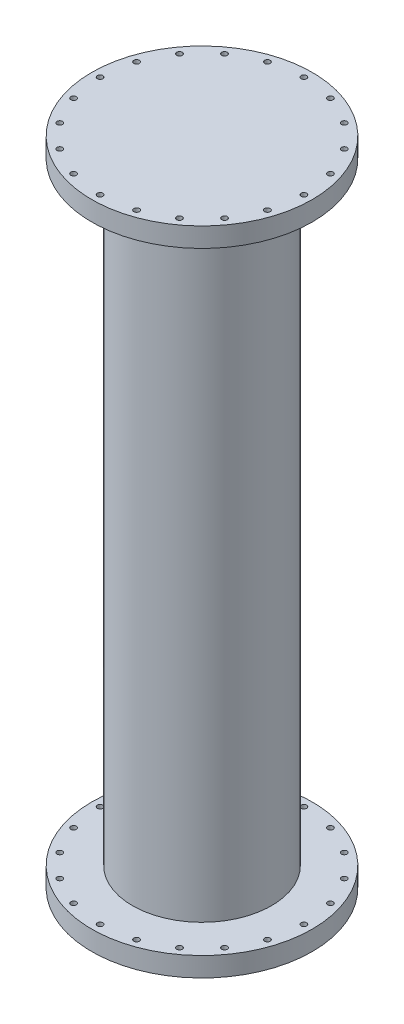
from build123d import *

# Parameters (mm, degrees)
ESQUISSE2_R                  = 10
ENL_V_MAT_EXTRU_1_DEPTH      = 2407.082292857
R_P_TITION_CIRCULAIRE1_COUNT = 20


with BuildPart() as part:
    # Esquisse1 → Révolution1 (revolve)
    with BuildSketch(Plane.XY, mode=Mode.PRIVATE) as r_volution1_sk:
        Polygon((0, 0), (396, 0), (396, -70), (250, -70), (250, -2270), (396, -2270), (396, -2340), (0, -2340), (0, -2270), (200, -2270), (200, -70), (0, -70), align=None)
    revolve(r_volution1_sk.sketch.rotate(Axis((0, 0, 0), (0, -1, 0)), 180), axis=Axis((0, 0, 0), (0, -1, 0)))

    # Esquisse2 → Enlèv. mat.-Extru.1 (cut, through all)
    with BuildSketch(Plane(origin=(0, 0, 0), x_dir=(1, 0, 0), z_dir=(0, 1, 0))):
        with Locations(Location((366, 0, 0), (0, 0, 180))):
            Circle(ESQUISSE2_R)
    enl_v_mat_extru_1 = extrude(amount=-ENL_V_MAT_EXTRU_1_DEPTH, mode=Mode.SUBTRACT)

    # Répétition circulaire1: Enlèv. mat.-Extru.1 ×20 about axis
    r_p_tition_circulaire1_axis = Axis((0, 0, 0), (0, 1, 0))
    for i in range(1, R_P_TITION_CIRCULAIRE1_COUNT):
        add(enl_v_mat_extru_1.rotate(r_p_tition_circulaire1_axis, i * 360 / R_P_TITION_CIRCULAIRE1_COUNT), mode=Mode.SUBTRACT)


solid = part.part
